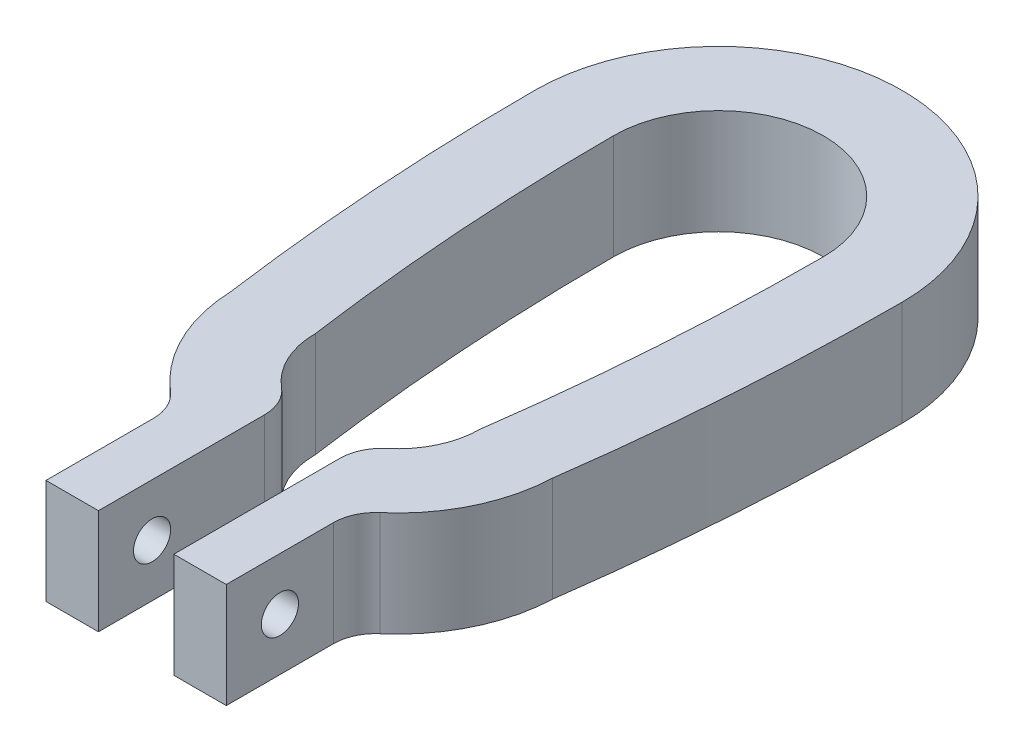
from build123d import *

# Parameters (mm, degrees)
BOSS_EXTRUDE1_DEPTH = 12.7
SKETCH3_R           = 2.249999945
CUT_EXTRUDE1_DEPTH  = 1397


with BuildPart() as part:
    # Sketch1 → Boss-Extrude1 (new body)
    with BuildSketch(Plane(origin=(0, 0, 0), x_dir=(1, 0, 0), z_dir=(0, 1, 0))):
        with BuildLine():
            Line((-4.562476894, -57.790786968), (-4.562476894, -70.490786968))
            Line((-4.562476894, -70.490786968), (-10.912476894, -70.490786968))
            Line((-10.912476894, -70.490786968), (-10.912476894, -57.505177075))
            ThreePointArc((-10.912476894, -57.505177075), (-11.378381687, -55.37996522), (-12.690636511, -53.644574779))
            ThreePointArc((-12.690636511, -53.644574779), (-17.570519454, -47.321172947), (-19.50995016, -39.572800421))
            ThreePointArc((-19.50995016, -39.572800421), (-21.545440648, -19.832914743), (-22.225, 0))
            ThreePointArc((-22.225, 0), (0, 22.225), (22.225, 0))
            ThreePointArc((22.225, 0), (21.545440648, -19.832914743), (19.50995016, -39.572800421))
            ThreePointArc((19.50995016, -39.572800421), (17.570519454, -47.321172947), (12.690636511, -53.644574779))
            ThreePointArc((12.690636511, -53.644574779), (11.378381687, -55.37996522), (10.912476894, -57.505177075))
            Line((10.912476894, -57.505177075), (10.912476894, -70.490786968))
            Line((10.912476894, -70.490786968), (4.562476894, -70.490786968))
            Line((4.562476894, -70.490786968), (4.562476894, -57.790786968))
            Line((4.562476894, -57.790786968), (4.562476894, -50.400688426))
            ThreePointArc((4.562476894, -50.400688426), (5.043152587, -48.243696093), (6.394215447, -46.494898164))
            ThreePointArc((6.394215447, -46.494898164), (9.053788005, -43.052382556), (10, -38.806334656))
            ThreePointArc((10, -38.806334656), (12.024185077, -19.450074611), (12.7, 0))
            ThreePointArc((12.7, 0), (0, 12.7), (-12.7, 0))
            ThreePointArc((-12.7, 0), (-12.024185077, -19.450074611), (-10, -38.806334656))
            ThreePointArc((-10, -38.806334656), (-9.053788005, -43.052382556), (-6.394215447, -46.494898164))
            ThreePointArc((-6.394215447, -46.494898164), (-5.043152587, -48.243696093), (-4.562476894, -50.400688426))
            Line((-4.562476894, -50.400688426), (-4.562476894, -57.790786968))
        make_face()
    extrude(amount=BOSS_EXTRUDE1_DEPTH)

    # Sketch3 → Cut-Extrude1 (cut)
    with BuildSketch(Plane.ZY.offset(10.912476894)):
        with Locations((63.997982022, 6.35)):
            Circle(SKETCH3_R)
    extrude(amount=-CUT_EXTRUDE1_DEPTH, mode=Mode.SUBTRACT)


solid = part.part
